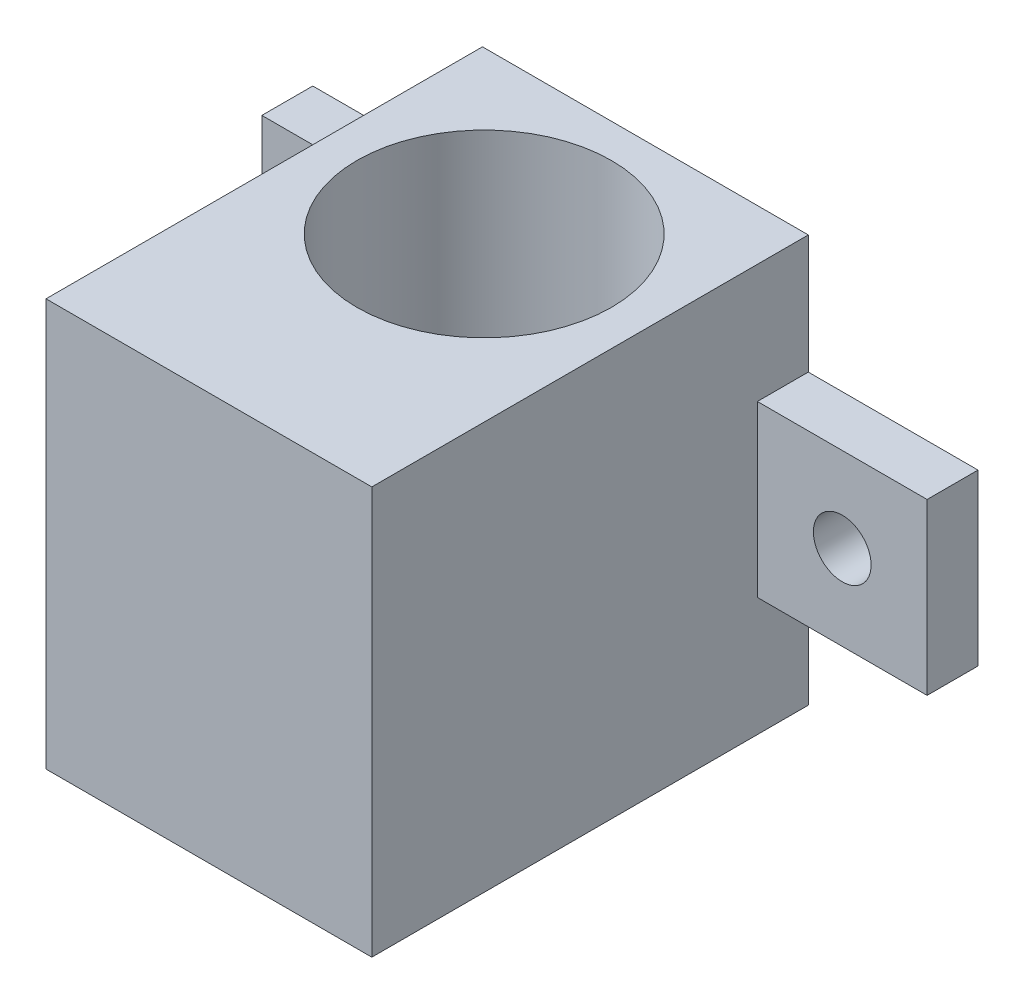
from build123d import *

# Parameters (mm, degrees)
SKETCH2_R           = 1700
BOSS_EXTRUDE1_DEPTH = 3000
SKETCH3_W           = 19200
SKETCH3_H           = 24000
BOSS_EXTRUDE2_DEPTH = 22720
SKETCH4_R           = 7500
CUT_EXTRUDE1_DEPTH  = 40271.068288991


with BuildPart() as part:
    # Sketch2 → Boss-Extrude1 (new body)
    with BuildSketch(Plane.XY):
        Polygon((-19600, 5000), (-9600, 5000), (-9600, 12000), (9600, 12000), (9600, 5000), (19600, 5000), (19600, -5000), (9600, -5000), (9600, -12000), (-9600, -12000), (-9600, -5000), (-19600, -5000), align=None)
        with Locations((-14600, 0)):
            Circle(SKETCH2_R, mode=Mode.SUBTRACT)
        with Locations((14600, 0)):
            Circle(SKETCH2_R, mode=Mode.SUBTRACT)
    extrude(amount=BOSS_EXTRUDE1_DEPTH)

    # Sketch3 → Boss-Extrude2 (add)
    with BuildSketch(Plane.XY.offset(3000)):
        Rectangle(SKETCH3_W, SKETCH3_H)
    extrude(amount=BOSS_EXTRUDE2_DEPTH)

    # Sketch4 → Cut-Extrude1 (cut, through all)
    with BuildSketch(Plane.XZ.offset(12000)):
        with Locations((0, 9500)):
            Circle(SKETCH4_R)
    extrude(amount=-CUT_EXTRUDE1_DEPTH, mode=Mode.SUBTRACT)


solid = part.part
